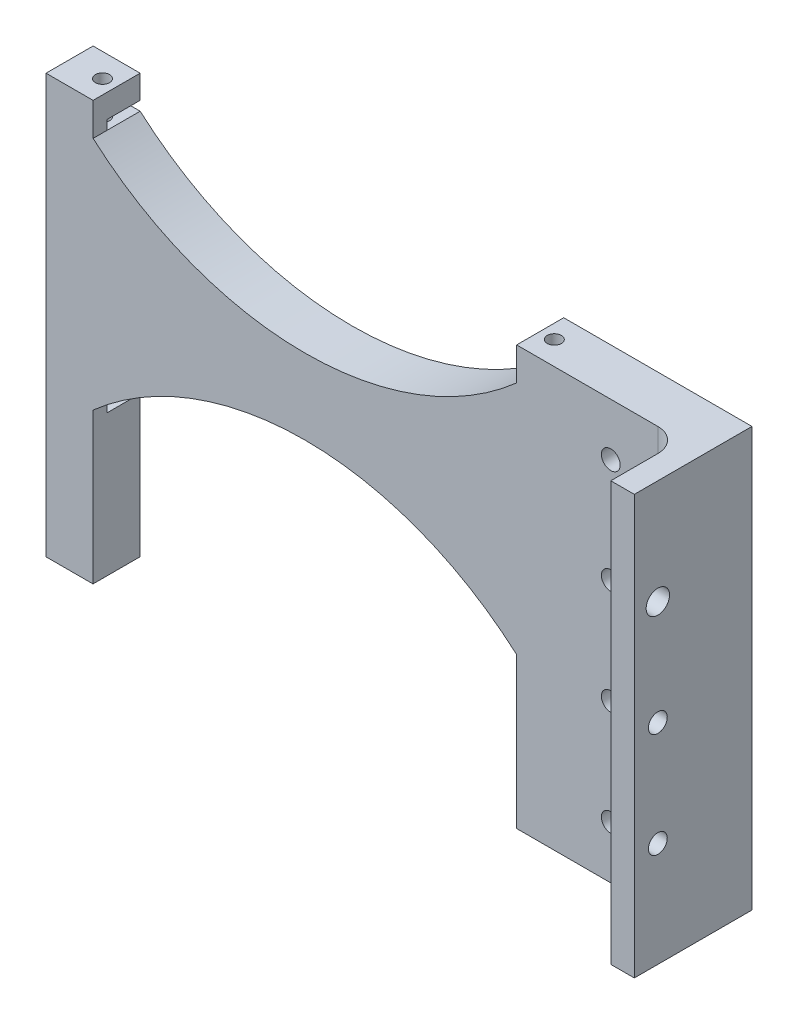
from build123d import *

# Parameters (mm, degrees)
BOSS_EXTRUDE1_DEPTH     = 10
CUT_EXTRUDE1_DEPTH      = 72.414284285
CUT_EXTRUDE1_DEPTH_BACK = 72.414284285
SKETCH2_R               = 1.5
SKETCH9_W               = 10
SKETCH9_H               = 50
BOSS_EXTRUDE9_DEPTH     = 5
SKETCH10_W              = 10
SKETCH10_H              = 50
BOSS_EXTRUDE10_DEPTH    = 5
BOSS_EXTRUDE11_DEPTH    = 2
SKETCH12_W              = 10
SKETCH12_H              = 10
BOSS_EXTRUDE12_DEPTH    = 5
CUT_EXTRUDE2_START      = 7
SKETCH13_R              = 1.5
CUT_EXTRUDE2_DEPTH      = 7
BOSS_EXTRUDE13_DEPTH    = 2
SKETCH15_W              = 9.981523119
SKETCH15_H              = 10
BOSS_EXTRUDE14_DEPTH    = 30
SKETCH16_R              = 1.5
CUT_EXTRUDE3_DEPTH      = 32
SKETCH18_W              = 10
SKETCH18_H              = 89
BOSS_EXTRUDE15_DEPTH    = 30
SKETCH19_W              = 5
SKETCH19_H              = 89
BOSS_EXTRUDE16_DEPTH    = 15
FILLET1_R               = 5
SKETCH20_R              = 2.48436703
SKETCH20_R_2            = 2
CUT_EXTRUDE4_DEPTH      = 149.657324071
SKETCH22_R              = 2
CUT_EXTRUDE5_DEPTH      = 104.435970532


with BuildPart() as part:
    # Sketch1 → Boss-Extrude1 (new body)
    with BuildSketch(Plane.XY):
        with BuildLine():
            Line((45.018476881, -25), (50, -25))
            Line((50, -25), (50, 25))
            Line((50, 25), (45, 25))
            ThreePointArc((45, 25), (0, 8), (-45, 25))
            Line((-45, 25), (-50, 25))
            Line((-50, 25), (-50, -25))
            Line((-50, -25), (-45.018476881, -25))
            ThreePointArc((-45.018476881, -25), (0, -8), (45.018476881, -25))
        make_face()
    extrude(amount=BOSS_EXTRUDE1_DEPTH)

    # Sketch2 → Cut-Extrude1 (cut, two sides: drawn at the far end of the back side and taken through both)
    with BuildSketch(Plane(origin=(0, 25, 0), x_dir=(1, 0, 0), z_dir=(0, 1, 0)).offset(-CUT_EXTRUDE1_DEPTH_BACK)):
        with Locations(Location((-48, -5, 0), (0, 0, 180))):
            Circle(SKETCH2_R)
        with Locations(Location((48, -5, 0), (0, 0, 180))):
            Circle(SKETCH2_R)
    extrude(amount=CUT_EXTRUDE1_DEPTH + CUT_EXTRUDE1_DEPTH_BACK, mode=Mode.SUBTRACT)

    # Sketch9 → Boss-Extrude9 (add)
    with BuildSketch(Plane(origin=(50, 0, 0), x_dir=(0, 0, -1), z_dir=(1, 0, 0))):
        with Locations((-5, 0)):
            Rectangle(SKETCH9_W, SKETCH9_H)
    extrude(amount=BOSS_EXTRUDE9_DEPTH)

    # Sketch10 → Boss-Extrude10 (add)
    with BuildSketch(Plane.ZY.offset(50)):
        with Locations((5, 0)):
            Rectangle(SKETCH10_W, SKETCH10_H)
    extrude(amount=BOSS_EXTRUDE10_DEPTH)

    # Sketch11 → Boss-Extrude11 (add)
    with BuildSketch(Plane(origin=(0, 25, 0), x_dir=(1, 0, 0), z_dir=(0, 1, 0))):
        Polygon((50, 0), (50, -7), (45, -7), (45, -10), (55, -10), (55, 0), align=None)
        Polygon((-50, 0), (-50, -7), (-45, -7), (-45, -10), (-55, -10), (-55, 0), align=None)
    extrude(amount=BOSS_EXTRUDE11_DEPTH)

    # Sketch12 → Boss-Extrude12 (add)
    with BuildSketch(Plane(origin=(0, 27, 0), x_dir=(1, 0, 0), z_dir=(0, 1, 0))):
        with Locations((50, -5)):
            Rectangle(SKETCH12_W, SKETCH12_H)
        with Locations((-50, -5)):
            Rectangle(SKETCH12_W, SKETCH12_H)
    extrude(amount=BOSS_EXTRUDE12_DEPTH)

    # Sketch13 → Cut-Extrude2 (cut)
    with BuildSketch(Plane(origin=(0, 25, 0), x_dir=(1, 0, 0), z_dir=(0, 1, 0)).offset(CUT_EXTRUDE2_START)):
        with Locations(Location((48, -5, 0), (0, 0, 180))):
            Circle(SKETCH13_R)
        with Locations(Location((-48, -5, 0), (0, 0, 180))):
            Circle(SKETCH13_R)
    extrude(amount=-CUT_EXTRUDE2_DEPTH, mode=Mode.SUBTRACT)

    # Sketch14 → Boss-Extrude13 (add)
    with BuildSketch(Plane.XZ.offset(25)):
        Polygon((50.009238441, 0), (50.009238441, 7), (45.018476881, 7), (45.018476881, 10), (55, 10), (55, 0), align=None)
        Polygon((-50.009238441, 0), (-50.009238441, 7), (-45.018476881, 7), (-45.018476881, 10), (-55, 10), (-55, 0), align=None)
    extrude(amount=BOSS_EXTRUDE13_DEPTH)

    # Sketch15 → Boss-Extrude14 (add)
    with BuildSketch(Plane.XZ.offset(27)):
        with Locations((-50.00923844, 5)):
            Rectangle(SKETCH15_W, SKETCH15_H)
        with Locations((50.00923844, 5)):
            Rectangle(SKETCH15_W, SKETCH15_H)
    extrude(amount=BOSS_EXTRUDE14_DEPTH)

    # Sketch16 → Cut-Extrude3 (cut)
    with BuildSketch(Plane.XZ.offset(25)):
        with Locations(Location((48, 5, 0), (0, 0, 180))):
            Circle(SKETCH16_R)
        with Locations(Location((-48, 5, 0), (0, 0, 180))):
            Circle(SKETCH16_R)
    extrude(amount=CUT_EXTRUDE3_DEPTH, mode=Mode.SUBTRACT)

    # Sketch18 → Boss-Extrude15 (add)
    with BuildSketch(Plane(origin=(55, 0, 0), x_dir=(0, 0, -1), z_dir=(1, 0, 0))):
        with Locations((-5, -12.5)):
            Rectangle(SKETCH18_W, SKETCH18_H)
    extrude(amount=BOSS_EXTRUDE15_DEPTH)

    # Sketch19 → Boss-Extrude16 (add)
    with BuildSketch(Plane.XY.offset(10)):
        with Locations((82.5, -12.5)):
            Rectangle(SKETCH19_W, SKETCH19_H)
    extrude(amount=BOSS_EXTRUDE16_DEPTH)

    # Fillet1
    fillet1_edges = [part.edges().sort_by_distance(p)[0] for p in [
        (80, -12.5, 10),
    ]]
    fillet(fillet1_edges, radius=FILLET1_R)

    # Sketch20 → Cut-Extrude4 (cut, through all)
    with BuildSketch(Plane.ZY.offset(-80)):
        with Locations(Location((20, 9.75, 0), (0, 0, 270))):
            Circle(SKETCH20_R)
        with Locations(Location((20, -12.5, 0), (0, 0, 270))):
            Circle(SKETCH20_R_2)
        with Locations(Location((20, -34.75, 0), (0, 0, 270))):
            Circle(SKETCH20_R_2)
    extrude(amount=-CUT_EXTRUDE4_DEPTH, mode=Mode.SUBTRACT)

    # Sketch22 → Cut-Extrude5 (cut, through all)
    with BuildSketch(Plane.XY.offset(10)):
        with Locations((65, 20.875)):
            Circle(SKETCH22_R)
        with Locations((65, -1.375)):
            Circle(SKETCH22_R)
        with Locations((65, -23.625)):
            Circle(SKETCH22_R)
        with Locations((65, -45.875)):
            Circle(SKETCH22_R)
    extrude(amount=-CUT_EXTRUDE5_DEPTH, mode=Mode.SUBTRACT)


solid = part.part
